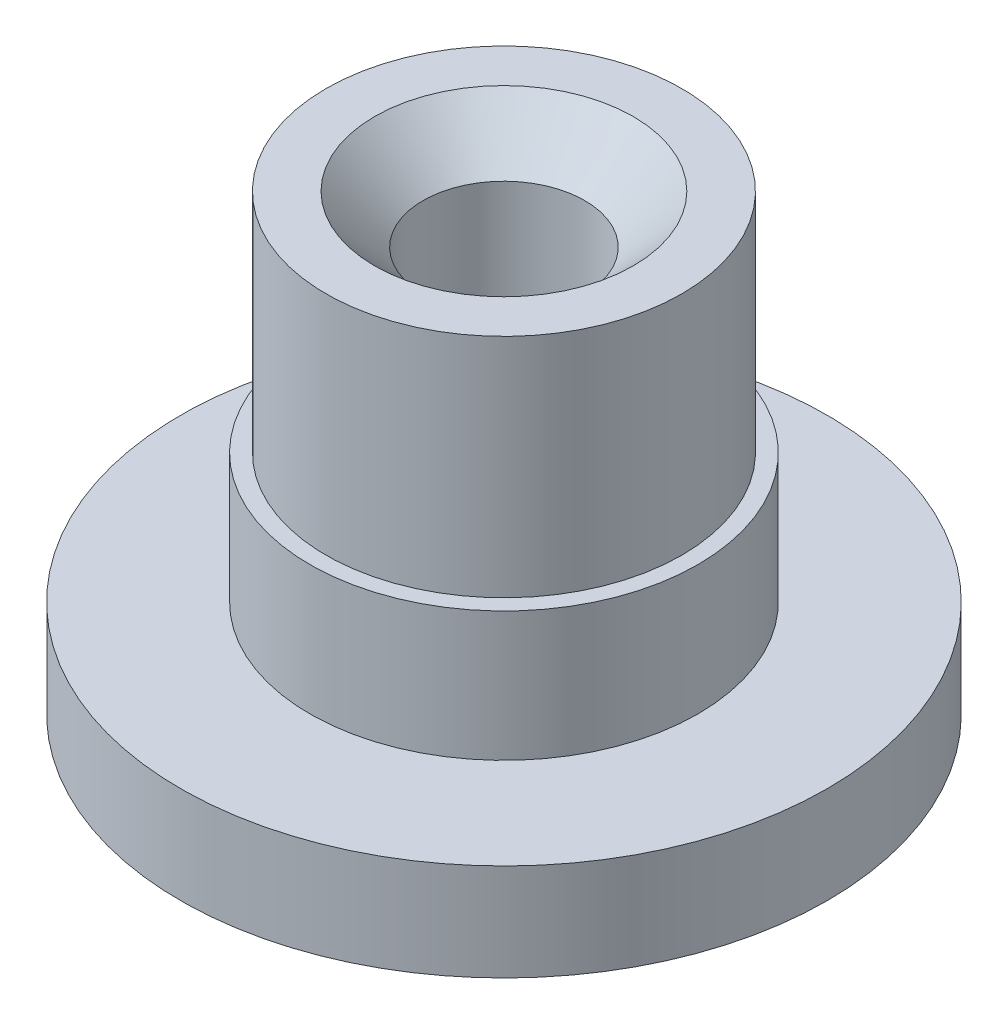
from build123d import *


with BuildPart() as part:
    # Sketch1 → Revolve1 (revolve)
    with BuildSketch(Plane.XY):
        Polygon((10, 0), (10, 3), (6, 3), (6, 7), (5.5, 7), (5.5, 14), (4, 14), (2.5, 12.5), (2.5, 0), align=None)
    revolve(axis=Axis((0, -1000, 0), (0, 1, 0)))


solid = part.part
